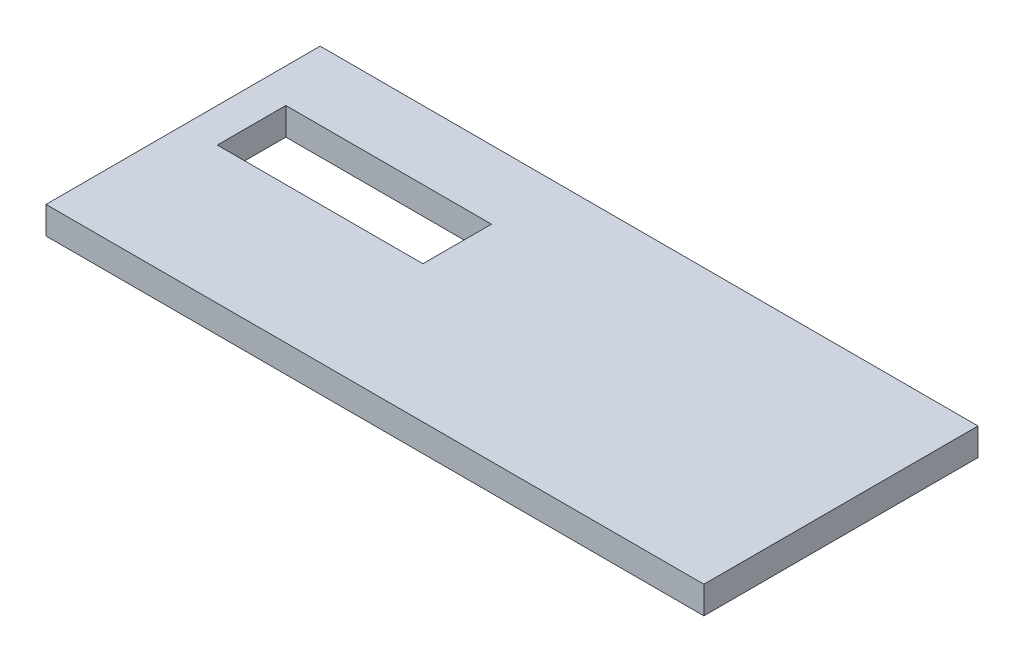
from build123d import *

# Parameters (mm, degrees)
SKETCH1_W           = 96
SKETCH1_H           = 40
SKETCH1_W_2         = 30
SKETCH1_H_2         = 10
BOSS_EXTRUDE1_DEPTH = 4


with BuildPart() as part:
    # Sketch1 → Boss-Extrude1 (new body)
    with BuildSketch(Plane(origin=(0, 0, 0), x_dir=(1, 0, 0), z_dir=(0, 1, 0))):
        with Locations((48, -20)):
            Rectangle(SKETCH1_W, SKETCH1_H)
        with Locations((20, -15)):
            Rectangle(SKETCH1_W_2, SKETCH1_H_2, mode=Mode.SUBTRACT)
    extrude(amount=BOSS_EXTRUDE1_DEPTH)


solid = part.part
